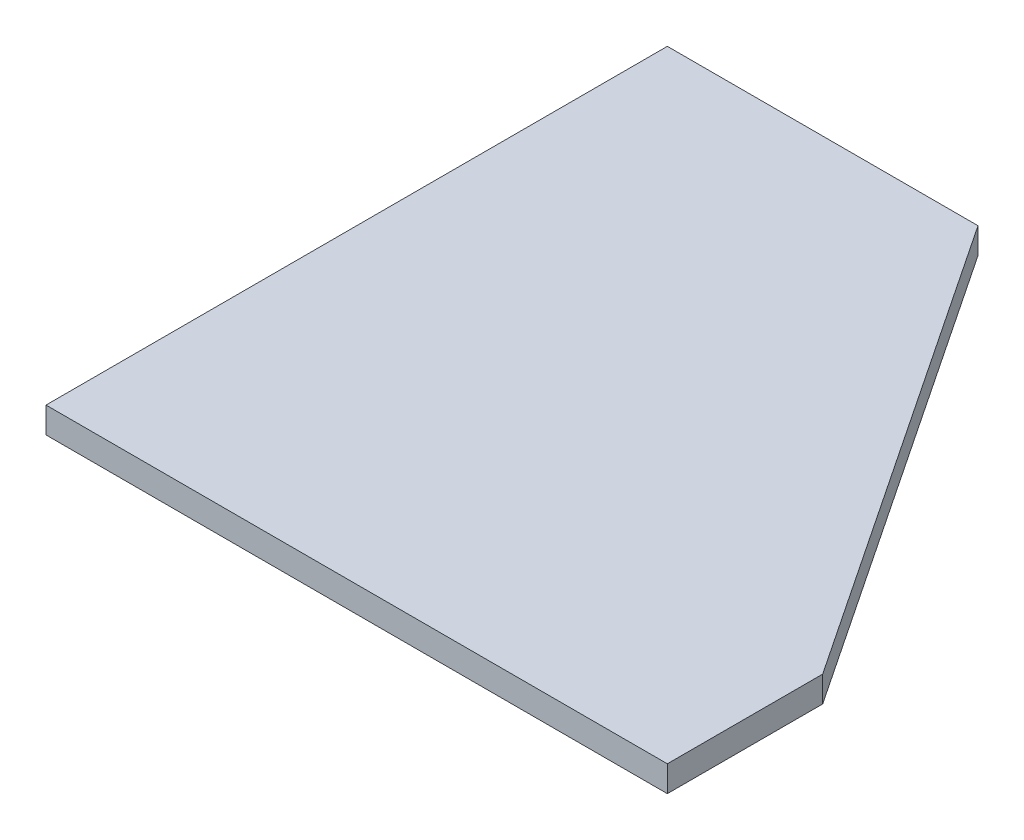
from build123d import *

# Parameters (mm, degrees)
EXTRUDE1_DEPTH = 6.35


with BuildPart() as part:
    # Sketch1 → Extrude1 (new body)
    with BuildSketch(Plane(origin=(0, 0, 0), x_dir=(1, 0, 0), z_dir=(0, 1, 0))):
        Polygon((0, 0), (0, 152.4), (76.2, 152.4), (152.4, 38.1), (152.4, 0), align=None)
    extrude(amount=EXTRUDE1_DEPTH)


solid = part.part
